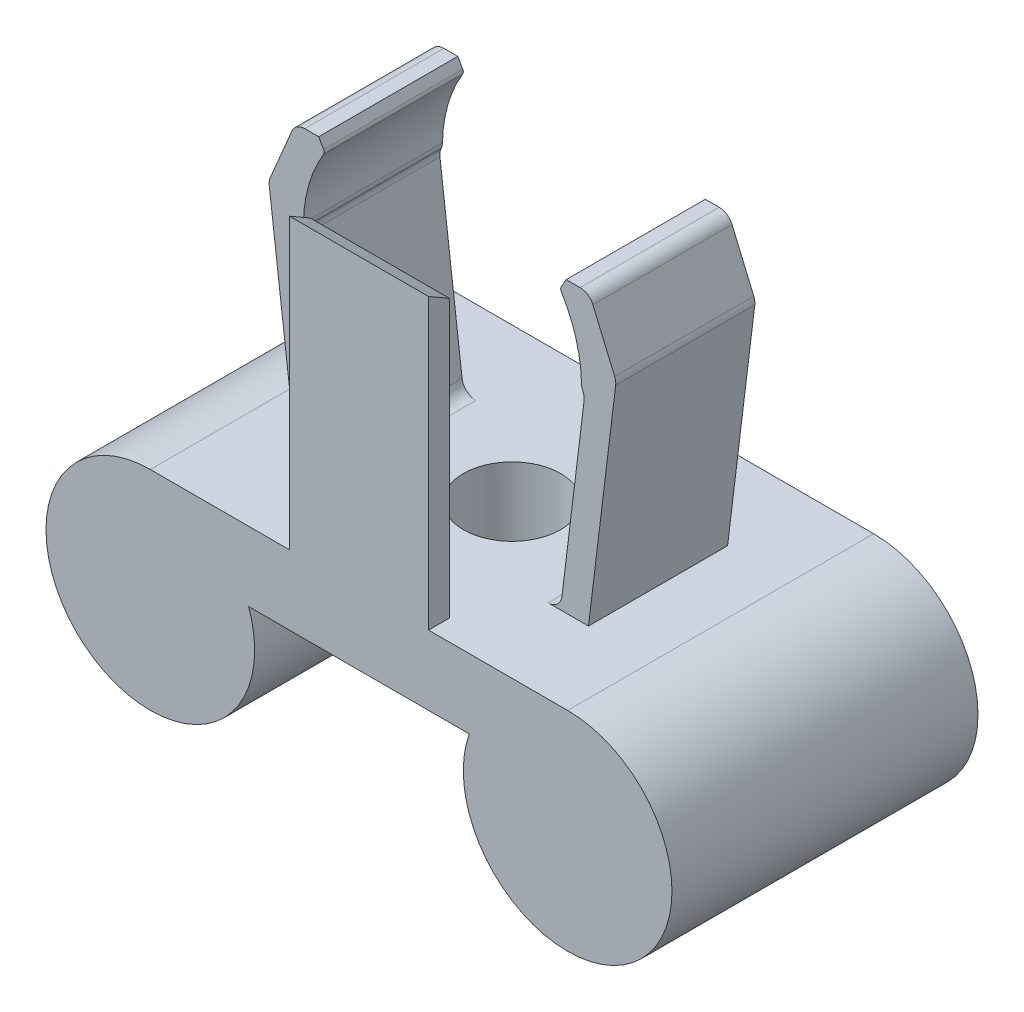
from build123d import *

# Parameters (mm, degrees)
EXTRUDE_1582_DEPTH      = 11
EXTRUDE_1582_DEPTH_BACK = 11
EXTRUDE_2052_DEPTH      = 5
EXTRUDE_2052_DEPTH_BACK = 5
EXTRUDE_2225_DEPTH      = 5
EXTRUDE_2225_DEPTH_BACK = 5
CUT_EXTRUDE_2419_REACH  = 32.666
SKETCH_4_R              = 3.5
EXTRUDE_5_DEPTH         = 22


with BuildPart() as part:
    # Эскиз1 → Extrude 1582 (new, two sides: drawn at the far end of the back side and taken through both)
    with BuildSketch(Plane.XY.offset(-EXTRUDE_1582_DEPTH_BACK)):
        with BuildLine():
            Line((9, 0), (-9, 0))
            ThreePointArc((-9, 0), (-9.662499048, 0.250937245), (-9.992506725, 0.877809978))
            Line((-9.992506725, 0.877809978), (-10.5, 5))
            Line((-10.5, 5), (10.5, 5))
            Line((10.5, 5), (9.992506725, 0.877809978))
            ThreePointArc((9.992506725, 0.877809978), (9.662499048, 0.250937245), (9, 0))
        make_face()
    extrude(amount=EXTRUDE_1582_DEPTH + EXTRUDE_1582_DEPTH_BACK)

    # Эскиз6 → Extrude 2052 (add, two sides: drawn at the far end of the back side and taken through both)
    with BuildSketch(Plane.XY.offset(-EXTRUDE_2052_DEPTH_BACK)):
        with BuildLine():
            Line((9.000000194, 0), (-9.000000194, 0))
            ThreePointArc((-9.000000194, 0), (-9.662731652, 0.251142861), (-9.992582561, 0.87842597))
            Line((-9.992582561, 0.87842597), (-12.453151595, 20.967563779))
            ThreePointArc((-12.453151595, 20.967563779), (-12.450795845, 21.228605534), (-12.380957788, 21.480142794))
            Line((-12.380957788, 21.480142794), (-10.816937846, 25.161697034))
            ThreePointArc((-10.816937846, 25.161697034), (-10.448362214, 25.604659969), (-9.896549286, 25.770692048))
            Line((-9.896549286, 25.770692048), (-8.896549286, 25.770692048))
            Line((-8.896549286, 25.770692048), (-8.540172772, 25.153429819))
            ThreePointArc((-8.540172772, 25.153429819), (-8.5, 25), (-8.543670285, 24.847528799))
            ThreePointArc((-8.543670285, 24.847528799), (-9.603061276, 22.440310879), (-9.99820781, 19.840144231))
            ThreePointArc((-9.99820781, 19.840144231), (-10.020066103, 19.650295162), (-10.077640031, 19.468070858))
            Line((-10.077640031, 19.468070858), (-10.11018486, 19.391463424))
            ThreePointArc((-10.11018486, 19.391463424), (-10.180022917, 19.139926164), (-10.182378667, 18.878884409))
            Line((-10.182378667, 18.878884409), (-8.590049232, 5.87842597))
            ThreePointArc((-8.590049232, 5.87842597), (-8.260198323, 5.251142861), (-7.597466865, 5))
            Line((-7.597466865, 5), (7.597466865, 5))
            ThreePointArc((7.597466865, 5), (8.260198323, 5.251142861), (8.590049232, 5.87842597))
            Line((8.590049232, 5.87842597), (10.182378667, 18.878884409))
            ThreePointArc((10.182378667, 18.878884409), (10.180022917, 19.139926164), (10.11018486, 19.391463424))
            Line((10.11018486, 19.391463424), (10.077640031, 19.468070858))
            ThreePointArc((10.077640031, 19.468070858), (10.020066103, 19.650295162), (9.99820781, 19.840144231))
            ThreePointArc((9.99820781, 19.840144231), (9.603061276, 22.440310879), (8.543670285, 24.847528799))
            ThreePointArc((8.543670285, 24.847528799), (8.5, 25), (8.540172772, 25.153429819))
            Line((8.540172772, 25.153429819), (8.896549286, 25.770692048))
            Line((8.896549286, 25.770692048), (9.896549286, 25.770692048))
            ThreePointArc((9.896549286, 25.770692048), (10.448362214, 25.604659969), (10.816937846, 25.161697034))
            Line((10.816937846, 25.161697034), (12.380957788, 21.480142794))
            ThreePointArc((12.380957788, 21.480142794), (12.450795845, 21.228605534), (12.453151595, 20.967563779))
            Line((12.453151595, 20.967563779), (9.992582561, 0.87842597))
            ThreePointArc((9.992582561, 0.87842597), (9.662731652, 0.251142861), (9.000000194, 0))
        make_face()
    extrude(amount=EXTRUDE_2052_DEPTH + EXTRUDE_2052_DEPTH_BACK)

    # Эскиз3 → Extrude 2225 (add, two sides: drawn at the far end of the back side and taken through both)
    with BuildSketch(Plane(origin=(0, 0, 0), x_dir=(0, 0, -1), z_dir=(1, 0, 0)).offset(-EXTRUDE_2225_DEPTH_BACK)):
        Polygon((-9.5, 5), (-11, 5), (-11, 25.770692048), (-9.5, 24.904666645), align=None)
    extrude(amount=EXTRUDE_2225_DEPTH + EXTRUDE_2225_DEPTH_BACK)

    # Эскиз4 → Cut-Extrude 2419 (cut, up to next)
    with BuildSketch(Plane.XZ, mode=Mode.PRIVATE) as cut_extrude_2419_sk1:
        Circle(SKETCH_4_R)
    cut_extrude_2419_tool1 = extrude(cut_extrude_2419_sk1.sketch, amount=-CUT_EXTRUDE_2419_REACH, mode=Mode.PRIVATE) & part.part
    add(cut_extrude_2419_tool1.solids().sort_by_distance((0, 0, 0))[0], mode=Mode.SUBTRACT)

    # Эскиз7 → Бобышка-Вытянуть5 (add)
    with BuildSketch(Plane(origin=(0, 0, -11), x_dir=(-1, 0, 0), z_dir=(0, 0, -1))):
        with BuildLine():
            Line((7.928932188, 0), (9, 0))
            ThreePointArc((9, 0), (9.662499048, 0.250937245), (9.992506725, 0.877809978))
            Line((9.992506725, 0.877809978), (10.5, 5))
            Line((10.5, 5), (15, 5))
            ThreePointArc((15, 5), (19.330127019, -8.623724357), (7.928932188, 0))
        make_face()
        with BuildLine():
            Line((-15, 5), (-10.5, 5))
            Line((-10.5, 5), (-9.992506725, 0.877809978))
            ThreePointArc((-9.992506725, 0.877809978), (-9.662499048, 0.250937245), (-9, 0))
            Line((-9, 0), (-7.928932188, 0))
            ThreePointArc((-7.928932188, 0), (-19.330127019, -8.623724357), (-15, 5))
        make_face()
    extrude(amount=-EXTRUDE_5_DEPTH)


solid = part.part
